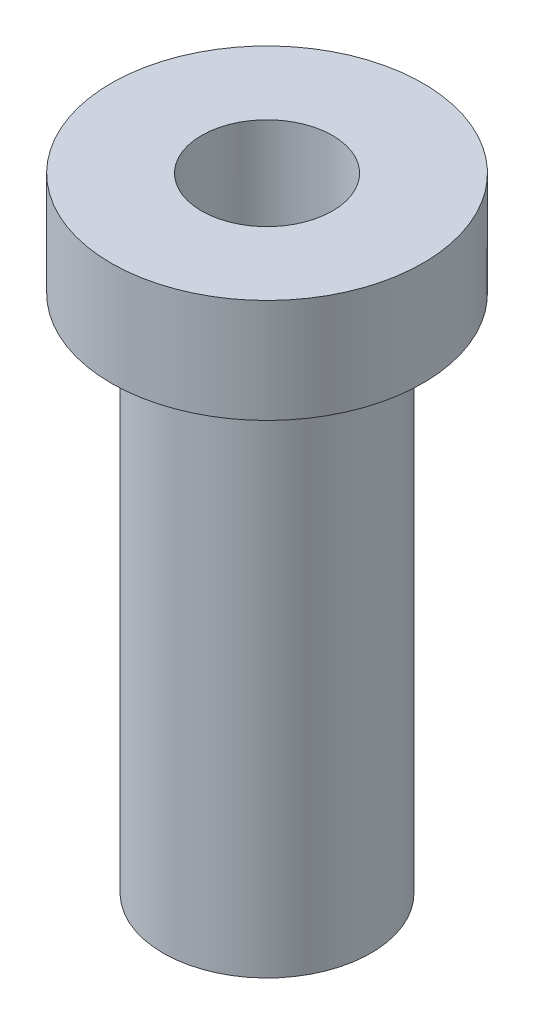
from build123d import *
from build123d.topology import SkipClean

# Parameters (mm, degrees)
SKETCH1_R           = 19.05
SKETCH1_R_2         = 8.001
BOSS_EXTRUDE2_DEPTH = 12.7
BOSS_EXTRUDE3_START = 63.5
SKETCH2_R           = 12.7
SKETCH2_R_2         = 8.001
BOSS_EXTRUDE3_DEPTH = 63.5


with BuildPart() as part:
    # Sketch1 → Boss-Extrude2 (new body)
    with BuildSketch(Plane(origin=(0, 0, 0), x_dir=(1, 0, 0), z_dir=(0, 1, 0))):
        with Locations(Location((0, 0, 0), (0, 0, 270))):
            Circle(SKETCH1_R)
        with Locations(Location((0, 0, 0), (0, 0, 270))):
            Circle(SKETCH1_R_2, mode=Mode.SUBTRACT)
    extrude(amount=BOSS_EXTRUDE2_DEPTH)

    # Sketch2 → Boss-Extrude3 (add)
    with SkipClean():  # the faces are left unmerged after this step: merging them gives an invalid solid
        with BuildSketch(Plane.XZ.offset(BOSS_EXTRUDE3_START)):
            with Locations(Location((0, 0, 0), (0, 0, 90))):
                Circle(SKETCH2_R)
            with Locations(Location((0, 0, 0), (0, 0, 270))):
                Circle(SKETCH2_R_2, mode=Mode.SUBTRACT)
        extrude(amount=-BOSS_EXTRUDE3_DEPTH)


solid = part.part
